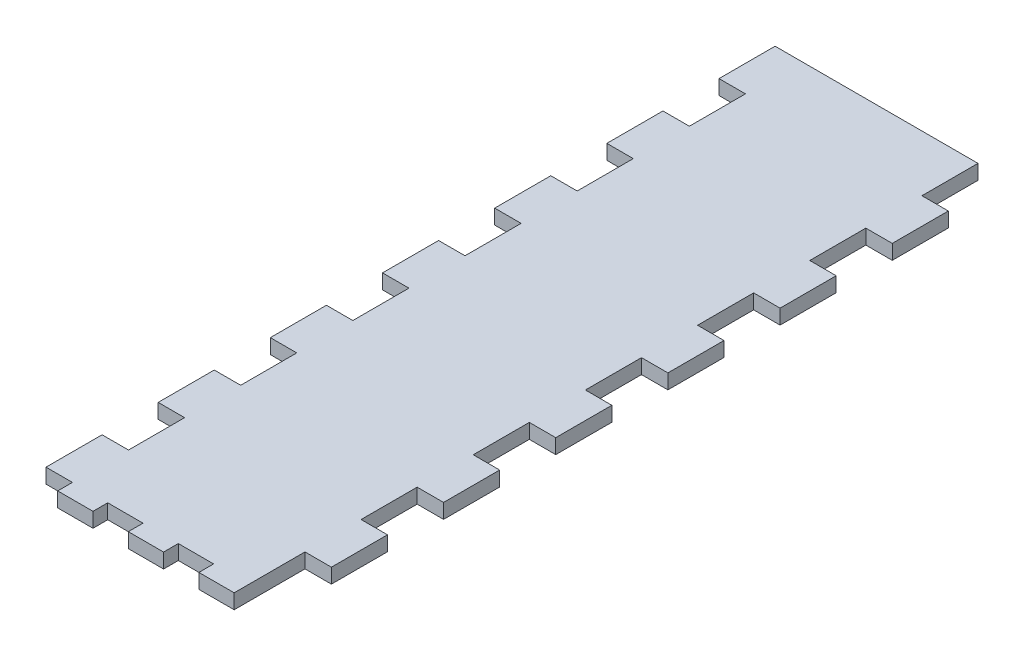
from build123d import *

# Parameters (mm, degrees)
BOSS_EXTRUDE3_DEPTH = 3.2


with BuildPart() as part:
    # Sketch1 → Boss-Extrude3 (new body)
    with BuildSketch(Plane(origin=(0, 0, 0), x_dir=(1, 0, 0), z_dir=(0, 1, 0))):
        Polygon((80.018202502, -34.385003933), (87.688185358, -34.385003933), (87.688185358, -31.185003933), (95.358168214, -31.185003933), (95.358168214, -34.385003933), (103.02815107, -34.385003933), (103.02815107, -31.185003933), (110.698133926, -31.185003933), (110.698133926, -34.385003933), (118.368116782, -34.385003933), (118.368116782, -18.996696241), (124.110679366, -18.996696241), (124.110679366, -6.808388549), (118.368116782, -6.808388549), (118.368116782, 5.379919143), (124.110679366, 5.379919143), (124.110679366, 17.568226836), (118.368116782, 17.568226836), (118.368116782, 29.756534528), (124.110679366, 29.756534528), (124.110679366, 41.94484222), (118.368116782, 41.94484222), (118.368116782, 54.133149913), (124.110679366, 54.133149913), (124.110679366, 66.321457605), (118.368116782, 66.321457605), (118.368116782, 78.509765297), (124.110679366, 78.509765297), (124.110679366, 90.69807299), (118.368116782, 90.69807299), (118.368116782, 102.886380682), (124.110679366, 102.886380682), (124.110679366, 115.074688374), (118.368116782, 115.074688374), (118.368116782, 127.262996067), (74.275639917, 127.262996067), (74.275639917, 115.074688374), (80.018202502, 115.074688374), (80.018202502, 102.886380682), (74.275639917, 102.886380682), (74.275639917, 90.69807299), (80.018202502, 90.69807299), (80.018202502, 78.509765297), (74.275639917, 78.509765297), (74.275639917, 66.321457605), (80.018202502, 66.321457605), (80.018202502, 54.133149913), (74.275639917, 54.133149913), (74.275639917, 41.94484222), (80.018202502, 41.94484222), (80.018202502, 29.756534528), (74.275639917, 29.756534528), (74.275639917, 17.568226836), (80.018202502, 17.568226836), (80.018202502, 5.379919143), (74.275639917, 5.379919143), (74.275639917, -6.808388549), (80.018202502, -6.808388549), (80.018202502, -18.996696241), (74.275639917, -18.996696241), (74.275639917, -31.185003933), (80.018202502, -31.185003933), align=None)
    extrude(amount=BOSS_EXTRUDE3_DEPTH)


solid = part.part
